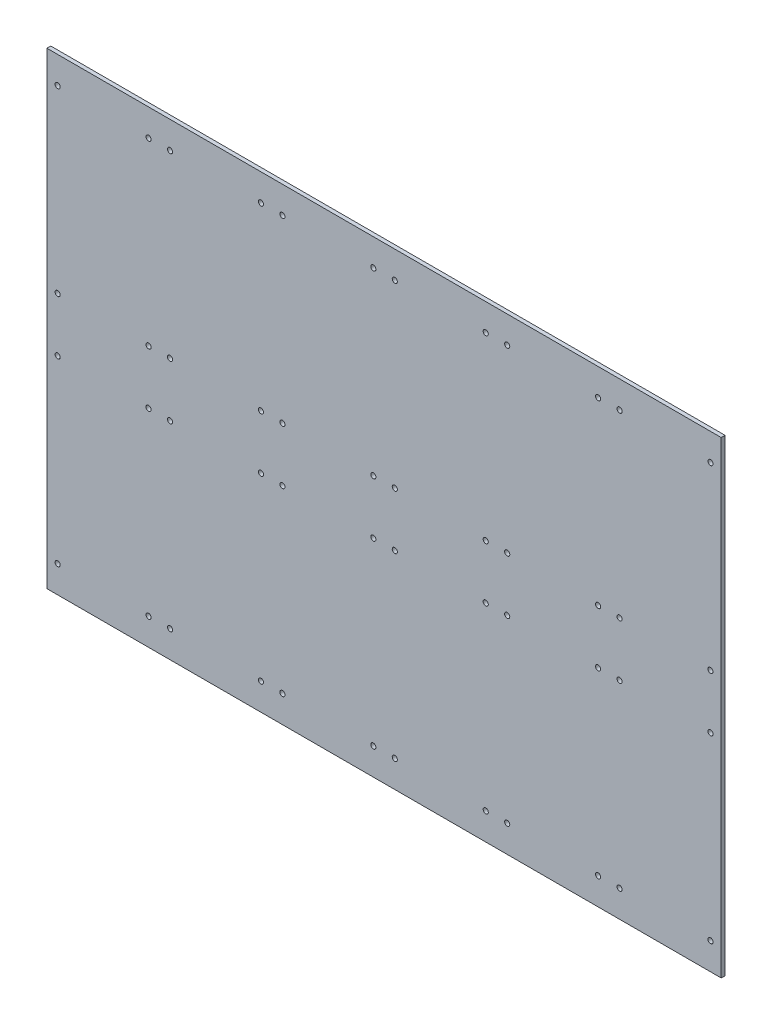
from build123d import *

# Parameters (mm, degrees)
SKETCH1_W            = 43.7
SKETCH1_H            = 91
SKETCH1_R            = 1
BOSS_EXTRUDE1_DEPTH  = 1.5
LPATTERN1_COUNT      = 6
LPATTERN1_PITCH      = 43.7
LPATTERN1_COUNT_DIR2 = 2
LPATTERN1_PITCH_DIR2 = 91


with BuildPart() as part:
    # Sketch1 → Boss-Extrude1 (new body)
    with BuildSketch(Plane.XY):
        Rectangle(SKETCH1_W, SKETCH1_H)
        with Locations((-17.675, 35)):
            Circle(SKETCH1_R, mode=Mode.SUBTRACT)
        with Locations(Location((17.675, 35, 0), (0, 0, 180))):
            Circle(SKETCH1_R, mode=Mode.SUBTRACT)
        with Locations((17.675, -35)):
            Circle(SKETCH1_R, mode=Mode.SUBTRACT)
        with Locations(Location((-17.675, -35, 0), (0, 0, 180))):
            Circle(SKETCH1_R, mode=Mode.SUBTRACT)
    boss_extrude1 = extrude(amount=BOSS_EXTRUDE1_DEPTH)

    # LPattern1: Boss-Extrude1 6 × 2
    with Locations(*[(-i * LPATTERN1_PITCH, j * LPATTERN1_PITCH_DIR2, 0) for i in range(LPATTERN1_COUNT) for j in range(LPATTERN1_COUNT_DIR2) if (i, j) != (0, 0)]):
        add(boss_extrude1)


solid = part.part
